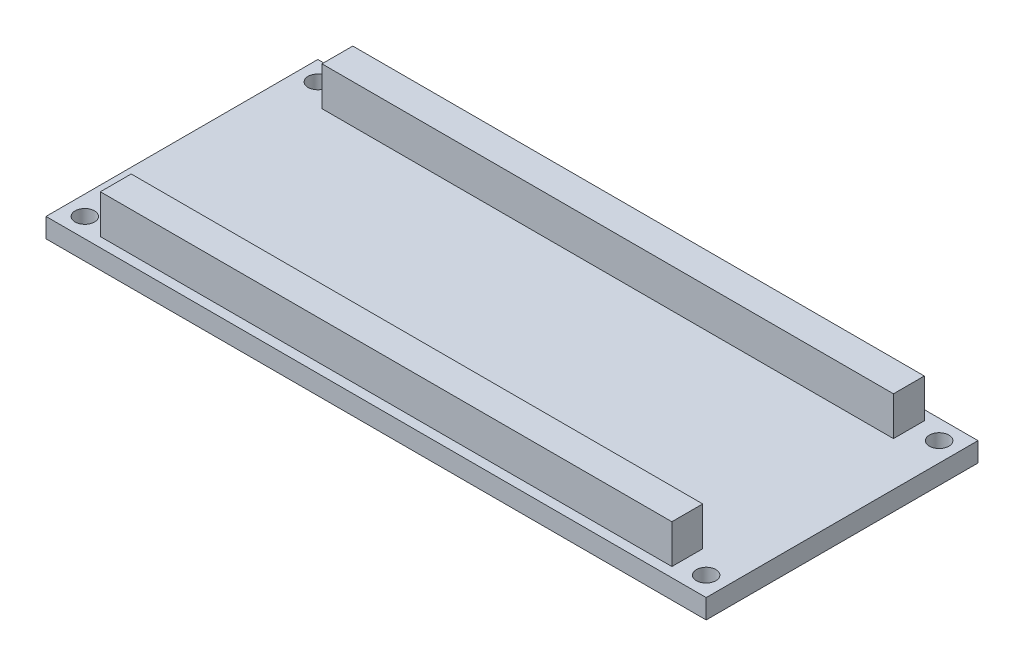
from build123d import *

# Parameters (mm, degrees)
SKETCH2_W                                  = 43.18
SKETCH2_H                                  = 17.78
BOSS_EXTRUDE1_DEPTH                        = 1.27
SKETCH3_R                                  = 0.635
CUT_EXTRUDE1_DEPTH                         = 24.383179852
MIRROR1_AT_THE_SECOND_PLANE_COPY_1_SKETC_R = 0.635
MIRROR1_AT_THE_SECOND_PLANE_COPY_1_DEPTH   = 24.383179852
SKETCH4_W                                  = 37.381103683
SKETCH4_H                                  = 2.016737313
BOSS_EXTRUDE2_DEPTH                        = 2.54


with BuildPart() as part:
    # Sketch2 → Boss-Extrude1 (new body)
    with BuildSketch(Plane(origin=(0, 0, 0), x_dir=(1, 0, 0), z_dir=(0, 1, 0))):
        Rectangle(SKETCH2_W, SKETCH2_H)
    extrude(amount=BOSS_EXTRUDE1_DEPTH)

    # Sketch3 → Cut-Extrude1 (cut, symmetric)
    with BuildSketch(Plane(origin=(0, 1.27, 0), x_dir=(1, 0, 0), z_dir=(0, 1, 0))):
        with Locations(Location((-20.32, 7.62, 0), (0, 0, 270))):
            Circle(SKETCH3_R)
    cut_extrude1 = extrude(amount=CUT_EXTRUDE1_DEPTH, both=True, mode=Mode.SUBTRACT)

    # Mirror1: Cut-Extrude1 across plane
    add(cut_extrude1.mirror(Plane(origin=(0, 0, 0), x_dir=(0, 0, 1), z_dir=(1, 0, 0))), mode=Mode.SUBTRACT)

    # Mirror1 at the second plane: Cut-Extrude1 across plane
    add(cut_extrude1.mirror(Plane.XY), mode=Mode.SUBTRACT)

    # Mirror1 at the second plane copy 1 sketc → Mirror1 at the second plane copy 1 (cut, symmetric)
    with BuildSketch(Plane(origin=(0, 1.27, 0), x_dir=(-1, 0, 0), z_dir=(0, 1, 0))):
        with Locations(Location((-20.32, 7.62, 0), (0, 0, 270))):
            Circle(MIRROR1_AT_THE_SECOND_PLANE_COPY_1_SKETC_R)
    extrude(amount=MIRROR1_AT_THE_SECOND_PLANE_COPY_1_DEPTH, both=True, mode=Mode.SUBTRACT)

    # Sketch4 → Boss-Extrude2 (add)
    with BuildSketch(Plane(origin=(0, 1.27, 0), x_dir=(1, 0, 0), z_dir=(0, 1, 0))):
        with Locations((0.021963045, -7.246631344)):
            Rectangle(SKETCH4_W, SKETCH4_H)
    boss_extrude2 = extrude(amount=BOSS_EXTRUDE2_DEPTH)

    # Mirror2: Boss-Extrude2 across plane
    add(boss_extrude2.mirror(Plane.XY))


solid = part.part
